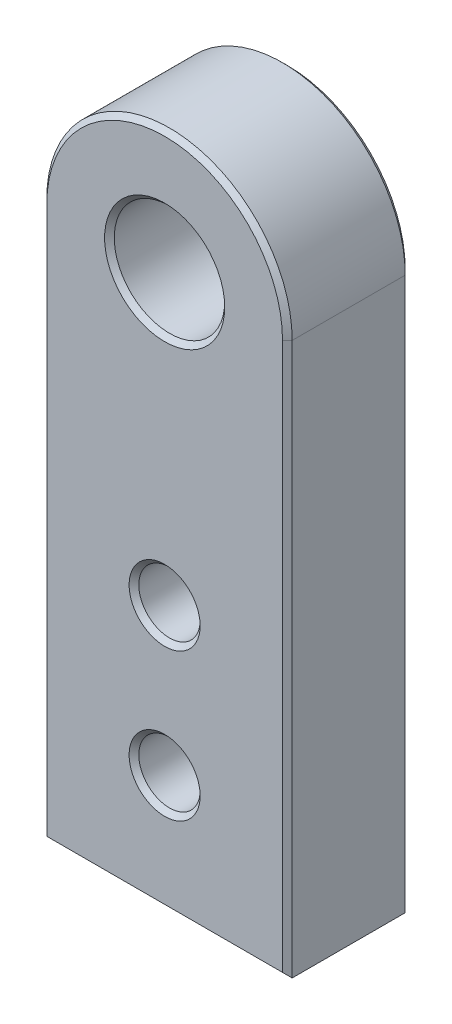
from build123d import *

# Parameters (mm, degrees)
SKETCH1_R           = 5.715
SKETCH1_R_2         = 3.175
BOSS_EXTRUDE1_DEPTH = 12.7
CHAMFER1_SIZE       = 0.5


with BuildPart() as part:
    # Sketch1 → Boss-Extrude1 (new body)
    with BuildSketch(Plane.XY):
        with BuildLine():
            Line((0, 0), (25.4, 0))
            Line((25.4, 0), (25.4, 40.64))
            Line((25.4, 40.64), (25.4, 57.15))
            ThreePointArc((25.4, 57.15), (12.7, 69.85), (0, 57.15))
            Line((0, 57.15), (0, 40.64))
            Line((0, 40.64), (0, 0))
        make_face()
        with Locations((12.7, 57.15)):
            Circle(SKETCH1_R, mode=Mode.SUBTRACT)
        with Locations((12.7, 27.305)):
            Circle(SKETCH1_R_2, mode=Mode.SUBTRACT)
        with Locations((12.7, 12.065)):
            Circle(SKETCH1_R_2, mode=Mode.SUBTRACT)
    extrude(amount=BOSS_EXTRUDE1_DEPTH)

    # Chamfer1
    chamfer1_edges = [part.edges().sort_by_distance(p)[0] for p in [
        (25.4, 28.575, 12.7),
        (9.525, 27.305, 0),
        (9.525, 27.305, 12.7),
        (12.7, 69.85, 12.7),
        (6.985, 57.15, 0),
        (6.985, 57.15, 12.7),
        (9.525, 12.065, 0),
        (9.525, 12.065, 12.7),
        (0, 28.575, 12.7),
        (0, 28.575, 0),
        (12.7, 69.85, 0),
        (25.4, 28.575, 0),
        (12.7, 0, 0),
        (12.7, 0, 12.7),
    ]]
    chamfer(chamfer1_edges, length=CHAMFER1_SIZE)


solid = part.part
